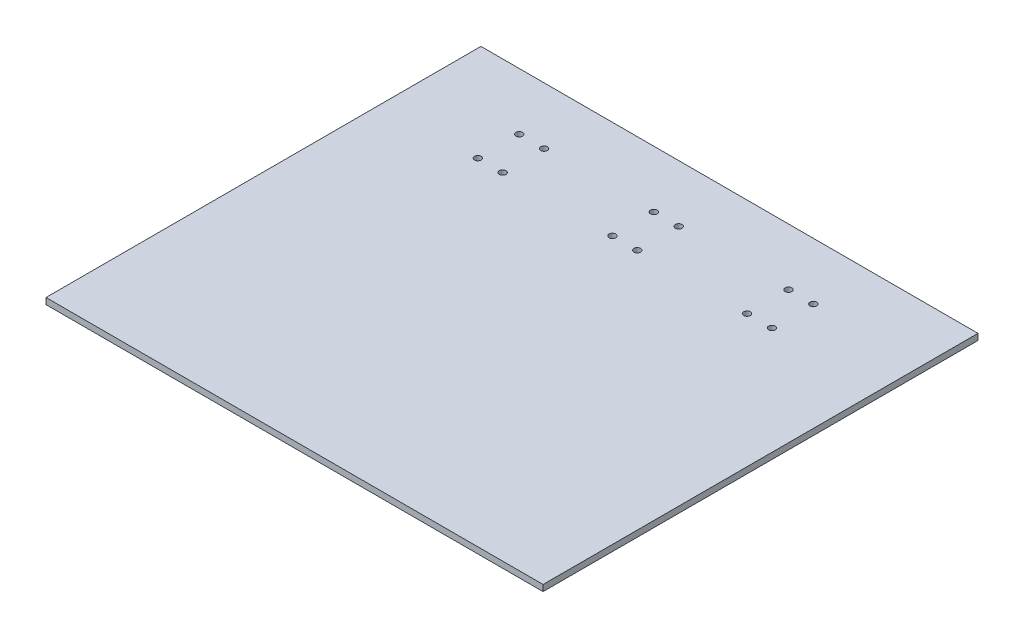
from build123d import *

# Parameters (mm, degrees)
SKETCH_1_W             = 240
SKETCH_1_H             = 210
EXTRUDE_1_DEPTH        = 3
SKETCH_2_R             = 1.6
CUT_EXTRUDE_1_DEPTH    = 160.48040632
PATTERN_LINEAR_1_COUNT = 3
PATTERN_LINEAR_1_PITCH = 65


with BuildPart() as part:
    # 草图1 → 凸台-拉伸1 (new body)
    with BuildSketch(Plane(origin=(0, 0, 0), x_dir=(1, 0, 0), z_dir=(0, 1, 0))):
        Rectangle(SKETCH_1_W, SKETCH_1_H)
    extrude(amount=EXTRUDE_1_DEPTH)

    # 草图2 → 切除-拉伸1 (cut, symmetric)
    with BuildSketch(Plane(origin=(0, 3, 0), x_dir=(1, 0, 0), z_dir=(0, 1, 0))):
        with Locations(Location((68, 77.5, 0), (0, 0, 270))):
            Circle(SKETCH_2_R)
        with Locations(Location((56, 77.5, 0), (0, 0, 270))):
            Circle(SKETCH_2_R)
        with Locations(Location((56, 57.5, 0), (0, 0, 270))):
            Circle(SKETCH_2_R)
        with Locations(Location((68, 57.5, 0), (0, 0, 270))):
            Circle(SKETCH_2_R)
    cut_extrude_1 = extrude(amount=CUT_EXTRUDE_1_DEPTH, both=True, mode=Mode.SUBTRACT)

    # 阵列(线性)1: 切除-拉伸1 ×3
    with Locations(*[(-i * PATTERN_LINEAR_1_PITCH, 0, 0) for i in range(1, PATTERN_LINEAR_1_COUNT)]):
        add(cut_extrude_1, mode=Mode.SUBTRACT)


solid = part.part
